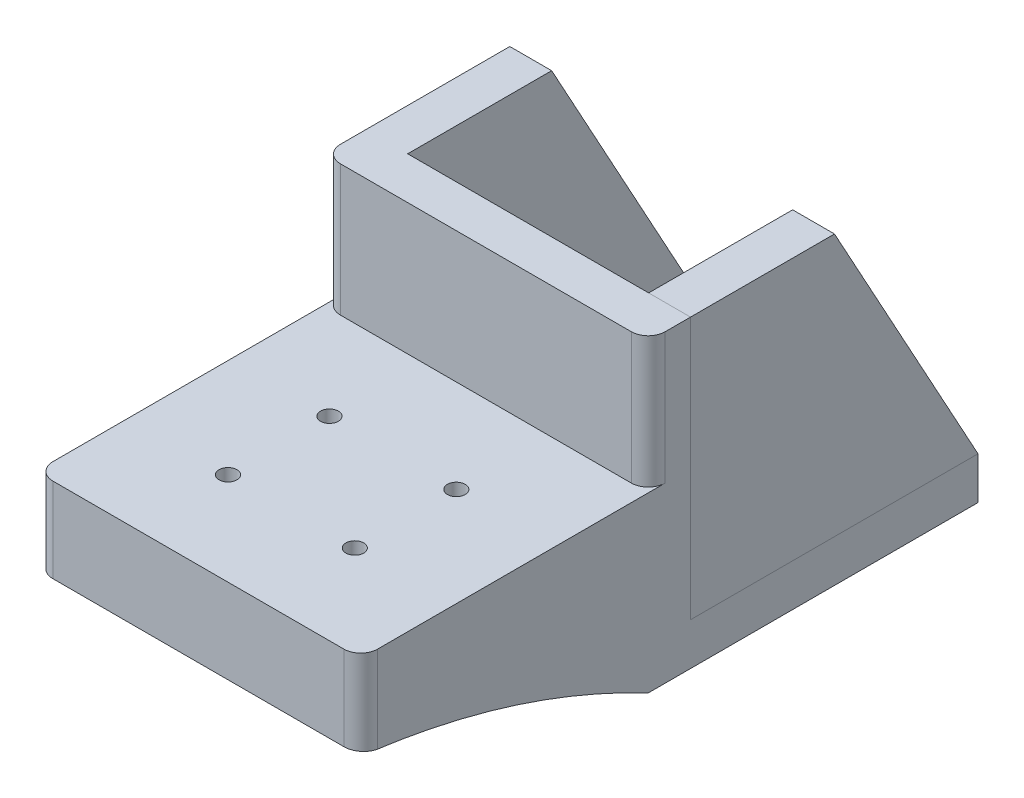
from build123d import *

# Parameters (mm, degrees)
SKETCH1_R           = 9.6
BOSS_EXTRUDE1_DEPTH = 15.7
SKETCH3_W           = 38.4
SKETCH3_H           = 34
BOSS_EXTRUDE2_DEPTH = 5
SKETCH2_R           = 1.1
CUT_EXTRUDE1_DEPTH  = 33.956486463
SKETCH7_W           = 38.4
SKETCH7_H           = 39
BOSS_EXTRUDE3_DEPTH = 20.5
SKETCH11_W          = 38.4
SKETCH11_H          = 5
BOSS_EXTRUDE7_DEPTH = 46.6
BOSS_EXTRUDE8_DEPTH = 4.95
BOSS_EXTRUDE9_DEPTH = 4.95
FILLET2_R           = 2
CUT_EXTRUDE5_DEPTH  = 108.081277542
SKETCH16_W          = 7
SKETCH16_H          = 13.8
CUT_EXTRUDE9_DEPTH  = 94.517271406
SKETCH18_R          = 1.05
CUT_EXTRUDE10_DEPTH = 76.34056044
SKETCH19_R          = 2.5
CUT_EXTRUDE11_DEPTH = 27.5
SKETCH20_W          = 39
SKETCH20_H          = 17.86072518
CUT_EXTRUDE12_DEPTH = 108.081277707
SKETCH21_R          = 8
CUT_EXTRUDE13_DEPTH = 3
FILLET3_R           = 2
SKETCH22_W          = 38.4
SKETCH22_H          = 31.1
CUT_EXTRUDE14_DEPTH = 94.517271406


with BuildPart() as part:
    # Sketch1 → Boss-Extrude1 (new body)
    with BuildSketch(Plane(origin=(0, 0, 0), x_dir=(1, 0, 0), z_dir=(0, 1, 0))):
        with Locations(Location((0, 0, 0), (0, 0, 270))):
            Circle(SKETCH1_R)
    extrude(amount=BOSS_EXTRUDE1_DEPTH)

    # Sketch3 → Boss-Extrude2 (add)
    with BuildSketch(Plane(origin=(0, 15.7, 0), x_dir=(1, 0, 0), z_dir=(0, 1, 0))):
        Rectangle(SKETCH3_W, SKETCH3_H)
    extrude(amount=BOSS_EXTRUDE2_DEPTH)

    # Sketch2 → Cut-Extrude1 (cut, through all)
    with BuildSketch(Plane(origin=(0, 0, 0), x_dir=(-1, 0, 0), z_dir=(0, -1, 0))):
        with Locations(Location((0, -6, 0), (0, 0, 90))):
            Circle(SKETCH2_R)
        with Locations(Location((0, 6, 0), (0, 0, 90))):
            Circle(SKETCH2_R)
        with Locations(Location((-6, 0, 0), (0, 0, 90))):
            Circle(SKETCH2_R)
        with Locations(Location((6, 0, 0), (0, 0, 90))):
            Circle(SKETCH2_R)
    extrude(amount=-CUT_EXTRUDE1_DEPTH, mode=Mode.SUBTRACT)

    # Sketch7 → Boss-Extrude3 (add)
    with BuildSketch(Plane.XZ.offset(-15.7)):
        with Locations((0, 36.5)):
            Rectangle(SKETCH7_W, SKETCH7_H)
    extrude(amount=-BOSS_EXTRUDE3_DEPTH)

    # Sketch11 → Boss-Extrude7 (add)
    with BuildSketch(Plane(origin=(0, 36.2, 0), x_dir=(1, 0, 0), z_dir=(0, 1, 0))):
        with Locations((0, -19.5)):
            Rectangle(SKETCH11_W, SKETCH11_H)
    extrude(amount=BOSS_EXTRUDE7_DEPTH)

    # Sketch13 → Boss-Extrude9 (add)
    with BuildSketch(Plane.ZY.offset(19.2)):
        Polygon((17, 82.8), (17, 20.7), (-17, 20.7), align=None)
    extrude(amount=-BOSS_EXTRUDE9_DEPTH)

    # Fillet2
    fillet2_edges = [part.edges().sort_by_distance(p)[0] for p in [
        (-19.2, 25.95, 56),
        (19.2, 25.95, 56),
    ]]
    fillet(fillet2_edges, radius=FILLET2_R)

    # Sketch15 → Cut-Extrude5 (cut, through all)
    with BuildSketch(Plane(origin=(19.2, 0, 0), x_dir=(0, 0, -1), z_dir=(1, 0, 0))):
        with BuildLine():
            Line((-56, 26.2), (-56, 15.7))
            Line((-56, 15.7), (-22, 15.7))
            add(Edge.make_bspline(
                [(-56, 26.2), (-38.064806405, 24.161238531), (-22, 15.7)],
                knots=[0, 0, 0, 1, 1, 1], degree=2))
        make_face()
    extrude(amount=-CUT_EXTRUDE5_DEPTH, mode=Mode.SUBTRACT)

    # Sketch16 → Cut-Extrude9 (cut, through all)
    with BuildSketch(Plane.XY.offset(22)):
        with Locations((-10.75, 58.6)):
            Rectangle(SKETCH16_W, SKETCH16_H)
        with Locations((10.75, 58.6)):
            Rectangle(SKETCH16_W, SKETCH16_H)
    extrude(amount=-CUT_EXTRUDE9_DEPTH, mode=Mode.SUBTRACT)

    # Sketch18 → Cut-Extrude10 (cut, through all)
    with BuildSketch(Plane(origin=(0, 36.2, 0), x_dir=(1, 0, 0), z_dir=(0, 1, 0))):
        with Locations(Location((-7.5, -33, 0), (0, 0, 270))):
            Circle(SKETCH18_R)
        with Locations(Location((-7.5, -45, 0), (0, 0, 270))):
            Circle(SKETCH18_R)
        with Locations(Location((7.5, -33, 0), (0, 0, 270))):
            Circle(SKETCH18_R)
        with Locations(Location((7.5, -45, 0), (0, 0, 270))):
            Circle(SKETCH18_R)
    extrude(amount=-CUT_EXTRUDE10_DEPTH, mode=Mode.SUBTRACT)

    # Sketch19 → Cut-Extrude11 (cut)
    with BuildSketch(Plane(origin=(0, 5.7, 0), x_dir=(-1, 0, 0), z_dir=(0, -1, 0))):
        with Locations(Location((-7.5, -33, 0), (0, 0, 90))):
            Circle(SKETCH19_R)
        with Locations(Location((7.5, -33, 0), (0, 0, 90))):
            Circle(SKETCH19_R)
        with Locations(Location((-7.5, -45, 0), (0, 0, 90))):
            Circle(SKETCH19_R)
        with Locations(Location((7.5, -45, 0), (0, 0, 90))):
            Circle(SKETCH19_R)
    extrude(amount=-CUT_EXTRUDE11_DEPTH, mode=Mode.SUBTRACT)

    # Sketch20 → Cut-Extrude12 (cut, through all)
    with BuildSketch(Plane(origin=(19.2, 0, 0), x_dir=(0, 0, -1), z_dir=(1, 0, 0))):
        with Locations((-2.5, 6.76963741)):
            Rectangle(SKETCH20_W, SKETCH20_H)
    extrude(amount=-CUT_EXTRUDE12_DEPTH, mode=Mode.SUBTRACT)

    # Sketch21 → Cut-Extrude13 (cut)
    with BuildSketch(Plane.XZ.offset(-15.7)):
        with Locations(Location((0, 0, 0), (0, 0, 270))):
            Circle(SKETCH21_R)
    extrude(amount=-CUT_EXTRUDE13_DEPTH, mode=Mode.SUBTRACT)

    # Fillet3
    fillet3_edges = [part.edges().sort_by_distance(p)[0] for p in [
        (-19.2, 59.5, 22),
        (19.2, 59.5, 22),
    ]]
    fillet(fillet3_edges, radius=FILLET3_R)


with BuildPart() as body_2:
    # Sketch12 → Boss-Extrude8 (new body)
    with BuildSketch(Plane(origin=(19.2, 0, 0), x_dir=(0, 0, -1), z_dir=(1, 0, 0))):
        Polygon((-17, 82.8), (-17, 20.7), (17, 20.7), align=None)
    extrude(amount=-BOSS_EXTRUDE8_DEPTH)


with BuildPart() as cut_extrude14_tool:
    # Sketch22 → Cut-Extrude14 (new, through all)
    with BuildSketch(Plane.XY.offset(22)):
        with Locations((0, 67.25)):
            Rectangle(SKETCH22_W, SKETCH22_H)
    extrude(amount=-CUT_EXTRUDE14_DEPTH)


with BuildPart() as part_1:
    add(part.part)

    # Cut-Extrude14: cut by cut_extrude14_tool
    add(cut_extrude14_tool.part, mode=Mode.SUBTRACT)


with BuildPart() as body_2_1:
    add(body_2.part)

    # Cut-Extrude14: cut by cut_extrude14_tool
    add(cut_extrude14_tool.part, mode=Mode.SUBTRACT)


solid = Compound([part_1.part, body_2_1.part])
